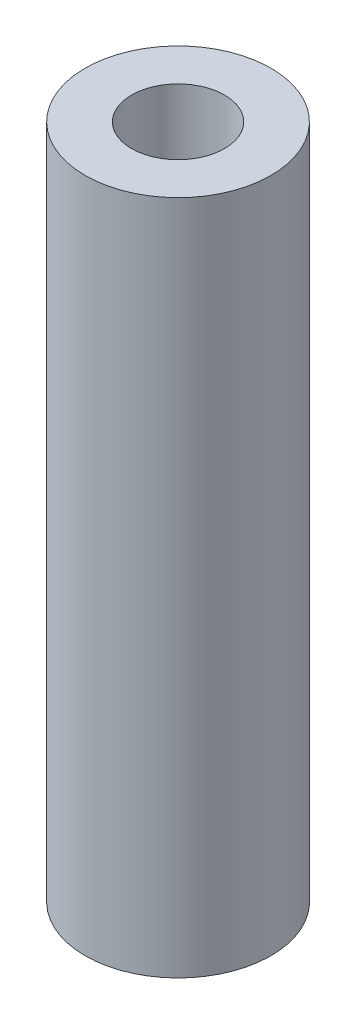
from build123d import *

# Parameters (mm, degrees)
SKETCH1_R           = 11
BOSS_EXTRUDE1_DEPTH = 80
CUT_EXTRUDE1_REACH  = 83.498
SKETCH2_R           = 5.5


with BuildPart() as part:
    # Sketch1 → Boss-Extrude1 (new body)
    with BuildSketch(Plane(origin=(0, 0, 0), x_dir=(1, 0, 0), z_dir=(0, 1, 0))):
        with Locations(Location((0, 0, 0), (0, 0, 270))):
            Circle(SKETCH1_R)
    extrude(amount=BOSS_EXTRUDE1_DEPTH)

    # Sketch2 → Cut-Extrude1 (cut, up to next)
    with BuildSketch(Plane(origin=(0, 80, 0), x_dir=(1, 0, 0), z_dir=(0, 1, 0)), mode=Mode.PRIVATE) as cut_extrude1_sk1:
        with Locations(Location((0, 0, 0), (0, 0, 270))):
            Circle(SKETCH2_R)
    cut_extrude1_tool1 = extrude(cut_extrude1_sk1.sketch, amount=-CUT_EXTRUDE1_REACH, mode=Mode.PRIVATE) & part.part
    add(cut_extrude1_tool1.solids().sort_by_distance((0, 80, 0))[0], mode=Mode.SUBTRACT)


solid = part.part
